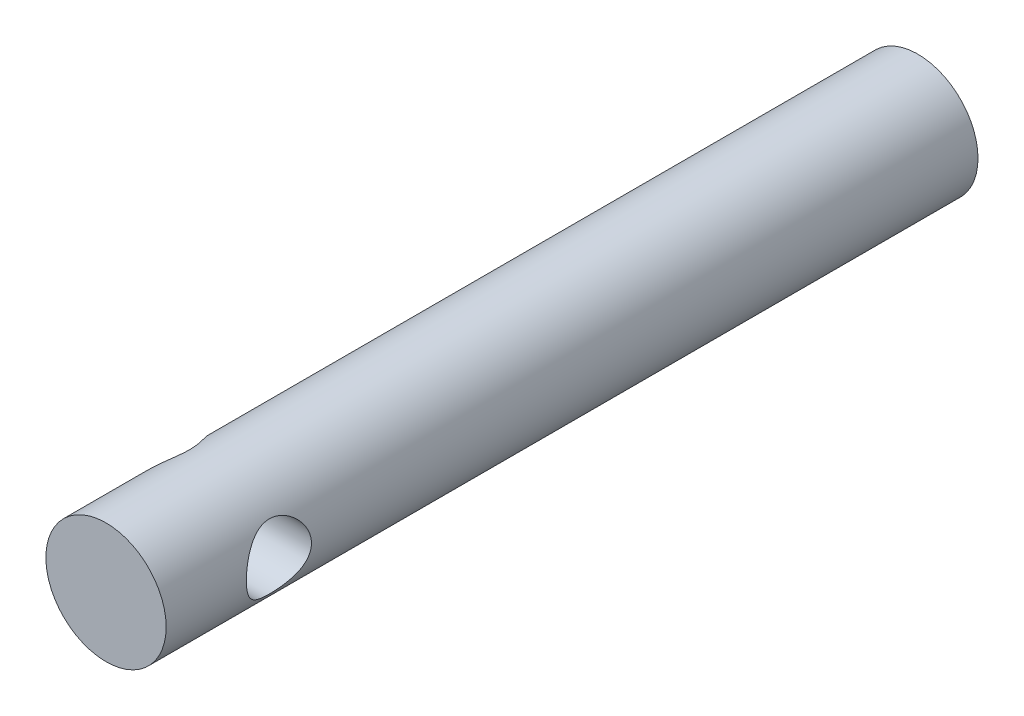
from build123d import *

# Parameters (mm, degrees)
SKETCH1_R           = 4
BOSS_EXTRUDE1_DEPTH = 54.002621
SKETCH2_R           = 2.165
CUT_EXTRUDE1_DEPTH  = 9
SKETCH4_R           = 3.5
CUT_EXTRUDE2_DEPTH  = 55.298094693


with BuildPart() as part:
    # Sketch1 → Boss-Extrude1 (new body)
    with BuildSketch(Plane.XY):
        Circle(SKETCH1_R)
    extrude(amount=BOSS_EXTRUDE1_DEPTH)

    # Sketch2 → Cut-Extrude1 (cut, symmetric)
    with BuildSketch(Plane(origin=(0, 0, 0), x_dir=(0, 0, -1), z_dir=(1, 0, 0))):
        with Locations(Location((-46.502621, 0, 0), (0, 0, 180))):
            Circle(SKETCH2_R)
    extrude(amount=CUT_EXTRUDE1_DEPTH, both=True, mode=Mode.SUBTRACT)

    # Sketch4 → Cut-Extrude2 (cut, through all)
    with BuildSketch(Plane(origin=(0, 0, 0), x_dir=(0, 0, -1), z_dir=(1, 0, 0))):
        with Locations((-46.502621, 0)):
            Circle(SKETCH4_R)
    extrude(amount=-CUT_EXTRUDE2_DEPTH, mode=Mode.SUBTRACT)


solid = part.part
